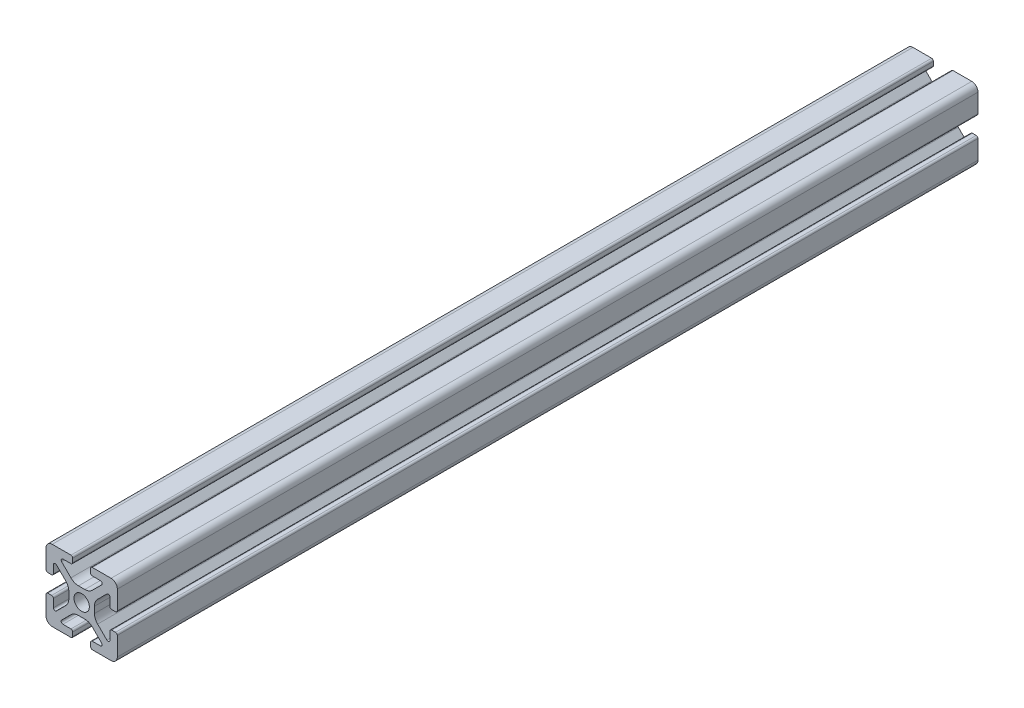
from build123d import *

# Parameters (mm, degrees)
BOSS_EXTRUDE1_DEPTH = 90.5
SCALE1_SCALE_X      = 0.75
SCALE1_SCALE_Y      = 0.75
SCALE1_SCALE_Z      = 1


with BuildPart() as part:
    # Sketch4 → Boss-Extrude1 (new, symmetric)
    with BuildSketch(Plane.XY):
        with BuildLine():
            Line((3, -10), (8.25, -10))
            ThreePointArc((8.25, -10), (9.487436867, -9.487436867), (10, -8.25))
            Line((10, -8.25), (10, -3))
            ThreePointArc((10, -3), (9.853553391, -2.646446609), (9.5, -2.5))
            Line((9.5, -2.5), (8.424621202, -2.5))
            ThreePointArc((8.424621202, -2.5), (8.071067812, -2.646446609), (7.924621202, -3))
            Line((7.924621202, -3), (7.924621202, -5.25))
            ThreePointArc((7.924621202, -5.25), (7.615962919, -5.711939766), (7.071067812, -5.603553391))
            Line((7.071067812, -5.603553391), (4.478679656, -3.011165235))
            ThreePointArc((4.478679656, -3.011165235), (3.828361402, -2.037895189), (3.6, -0.889844892))
            Line((3.6, -0.889844892), (3.6, 0))
            Line((3.6, 0), (2.15, 0))
            ThreePointArc((2.15, 0), (1.52027958, -1.52027958), (0, -2.15))
            Line((0, -2.15), (0, -3.6))
            Line((0, -3.6), (0.889844892, -3.6))
            ThreePointArc((0.889844892, -3.6), (2.037895189, -3.828361402), (3.011165235, -4.478679656))
            Line((3.011165235, -4.478679656), (5.603553391, -7.071067812))
            ThreePointArc((5.603553391, -7.071067812), (5.711939766, -7.615962919), (5.25, -7.924621202))
            Line((5.25, -7.924621202), (3, -7.924621202))
            ThreePointArc((3, -7.924621202), (2.646446609, -8.071067812), (2.5, -8.424621202))
            Line((2.5, -8.424621202), (2.5, -9.5))
            ThreePointArc((2.5, -9.5), (2.646446609, -9.853553391), (3, -10))
        make_face()
    extrude(amount=BOSS_EXTRUDE1_DEPTH, both=True)

    # Mirror1: part across plane


with BuildPart() as part_1:
    add(part.part)
    add(part.part.mirror(Plane(origin=(0, 0, 0), x_dir=(0, 0, 1), z_dir=(1, 0, 0))))

    # Mirror2: part across plane


with BuildPart() as part_2:
    add(part_1.part)
    add(part_1.part.mirror(Plane.ZX))


with BuildPart() as part_3:
    # Scale1: scaled about (0, 0, 0)
    add(part_2.part.scale((SCALE1_SCALE_X, SCALE1_SCALE_Y, SCALE1_SCALE_Z), about=(0, 0, 0)))


solid = part_3.part
